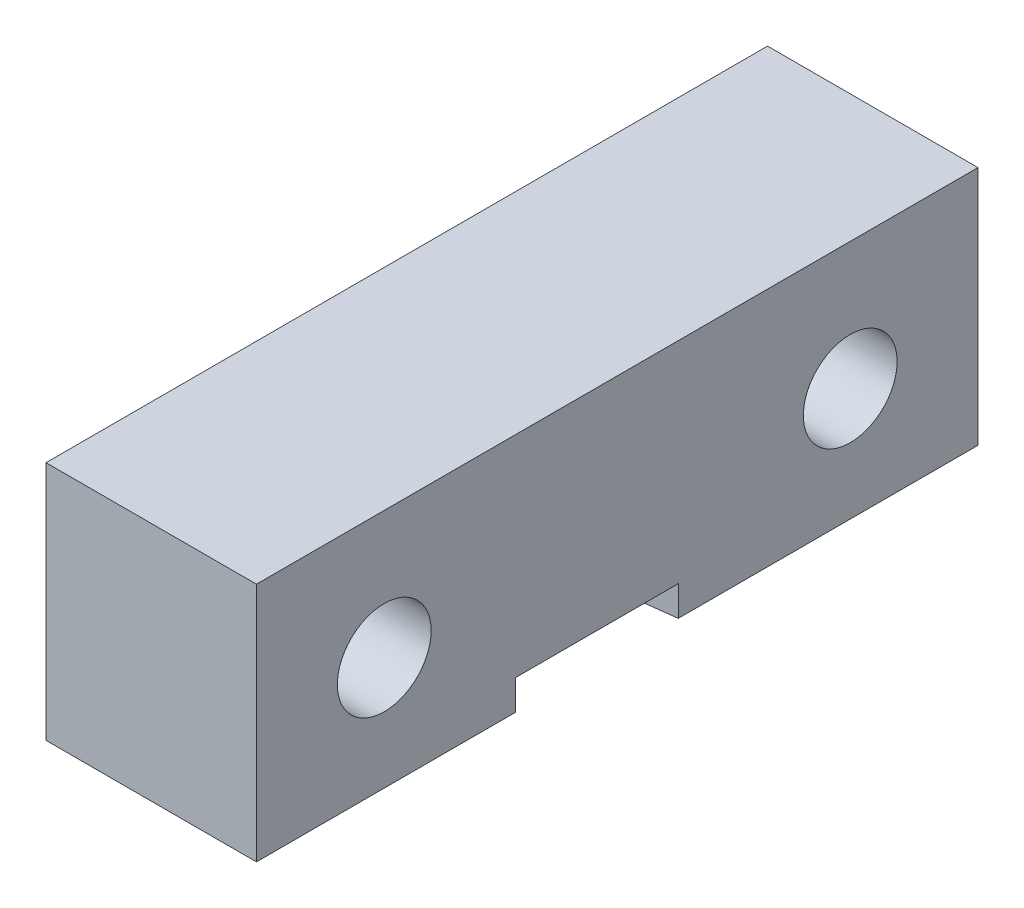
from build123d import *

# Parameters (mm, degrees)
SKETCH1_W           = 44.45
SKETCH1_H           = 50.8
BOSS_EXTRUDE1_DEPTH = 76.2
CUT_EXTRUDE1_REACH  = 93.801
SKETCH2_R           = 6.731
SKETCH3_R           = 9.906
CUT_EXTRUDE2_DEPTH  = 38.608
CUT_EXTRUDE3_DEPTH  = 6.35


with BuildPart() as part:
    # Sketch1 → Boss-Extrude1 (new, symmetric)
    with BuildSketch(Plane.XY):
        Rectangle(SKETCH1_W, SKETCH1_H)
    extrude(amount=BOSS_EXTRUDE1_DEPTH, both=True)

    # Sketch2 → Cut-Extrude1 (cut, up to next)
    with BuildSketch(Plane(origin=(22.225, 0, 0), x_dir=(0, 0, -1), z_dir=(1, 0, 0)), mode=Mode.PRIVATE) as cut_extrude1_sk1:
        with Locations((-49.2125, -1.524)):
            Circle(SKETCH2_R)
    cut_extrude1_tool1 = extrude(cut_extrude1_sk1.sketch, amount=-CUT_EXTRUDE1_REACH, mode=Mode.PRIVATE) & part.part
    # Sketch2 → Cut-Extrude1 (cut, up to next)
    with BuildSketch(Plane(origin=(22.225, 0, 0), x_dir=(0, 0, -1), z_dir=(1, 0, 0)), mode=Mode.PRIVATE) as cut_extrude1_sk2:
        with Locations((49.2125, -1.524)):
            Circle(SKETCH2_R)
    cut_extrude1_tool2 = extrude(cut_extrude1_sk2.sketch, amount=-CUT_EXTRUDE1_REACH, mode=Mode.PRIVATE) & part.part
    add(cut_extrude1_tool1.solids().sort_by_distance((22.225, -1.524, 49.2125))[0], mode=Mode.SUBTRACT)
    add(cut_extrude1_tool2.solids().sort_by_distance((22.225, -1.524, -49.2125))[0], mode=Mode.SUBTRACT)

    # Sketch3 → Cut-Extrude2 (cut)
    with BuildSketch(Plane(origin=(22.225, 0, 0), x_dir=(0, 0, -1), z_dir=(1, 0, 0))):
        with Locations((-49.2125, -1.524)):
            Circle(SKETCH3_R)
        with Locations((49.2125, -1.524)):
            Circle(SKETCH3_R)
    extrude(amount=-CUT_EXTRUDE2_DEPTH, mode=Mode.SUBTRACT)

    # Sketch4 → Cut-Extrude3 (cut)
    with BuildSketch(Plane.XZ.offset(25.4)):
        with BuildLine():
            Line((22.225, -12.890241244), (22.225, 21.531765175))
            Line((22.225, 21.531765175), (0.947246364, 18.89010908))
            ThreePointArc((0.947246364, 18.89010908), (-11.925153457, 4.320761965), (0.947246364, -10.248585149))
            Line((0.947246364, -10.248585149), (22.225, -12.890241244))
        make_face()
    extrude(amount=-CUT_EXTRUDE3_DEPTH, mode=Mode.SUBTRACT)


solid = part.part
